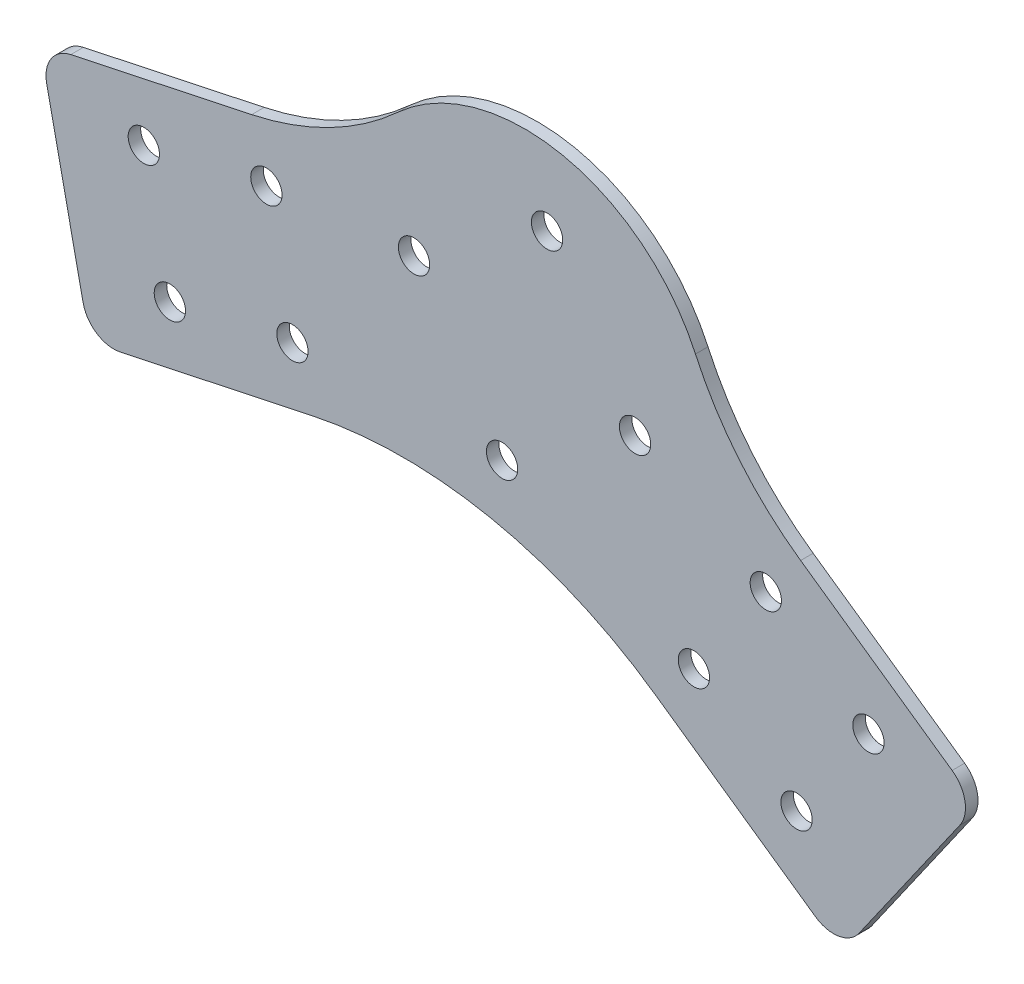
from build123d import *

# Parameters (mm, degrees)
SKETCH1_R           = 2.5
BOSS_EXTRUDE1_DEPTH = 2
FILLET1_R           = 50
FILLET2_R           = 70
FILLET3_R           = 5


with BuildPart() as part:
    # Sketch1 → Boss-Extrude1 (new body)
    with BuildSketch(Plane.XY):
        with BuildLine():
            Line((-77.311392181, 2.991427603), (-69.410747929, -34.178181225))
            Line((-69.410747929, -34.178181225), (-4.13058082, -20.302453359))
            Line((-4.13058082, -20.302453359), (50.538451031, -58.582121568))
            Line((50.538451031, -58.582121568), (72.334355612, -27.454343885))
            Line((72.334355612, -27.454343885), (29.915692131, 2.247524046))
            ThreePointArc((29.915692131, 2.247524046), (5.981038033, 29.397741139), (-26.659362194, 13.757848938))
            Line((-26.659362194, 13.757848938), (-77.311392181, 2.991427603))
        make_face()
        with Locations((-60.767972952, -2.693225442)):
            Circle(SKETCH1_R, mode=Mode.SUBTRACT)
        with Locations(Location((-56.609739136, -22.256177456, 0), (0, 0, 180))):
            Circle(SKETCH1_R, mode=Mode.SUBTRACT)
        with Locations((-37.046787121, -18.09794364)):
            Circle(SKETCH1_R, mode=Mode.SUBTRACT)
        with Locations(Location((-41.205020938, 1.465008375, 0), (0, 0, 180))):
            Circle(SKETCH1_R, mode=Mode.SUBTRACT)
        with Locations((38.501846135, -14.751537011)):
            Circle(SKETCH1_R, mode=Mode.SUBTRACT)
        with Locations(Location((27.030317408, -31.134577897, 0), (0, 0, 180))):
            Circle(SKETCH1_R, mode=Mode.SUBTRACT)
        with Locations((43.413358294, -42.606106624)):
            Circle(SKETCH1_R, mode=Mode.SUBTRACT)
        with Locations(Location((54.884887021, -26.223065738, 0), (0, 0, 180))):
            Circle(SKETCH1_R, mode=Mode.SUBTRACT)
        with Locations((3.58862282, 17.638644683)):
            Circle(SKETCH1_R, mode=Mode.SUBTRACT)
        with Locations((17.638644683, -3.58862282)):
            Circle(SKETCH1_R, mode=Mode.SUBTRACT)
        with Locations((-3.58862282, -17.638644683)):
            Circle(SKETCH1_R, mode=Mode.SUBTRACT)
        with Locations((-17.638644683, 3.58862282)):
            Circle(SKETCH1_R, mode=Mode.SUBTRACT)
    extrude(amount=BOSS_EXTRUDE1_DEPTH)

    # Fillet1
    fillet1_edges = [part.edges().sort_by_distance(p)[0] for p in [
        (-26.659362194, 13.757848938, 1),
        (29.915692131, 2.247524046, 1),
    ]]
    fillet(fillet1_edges, radius=FILLET1_R)

    # Fillet2
    fillet2_edges = [part.edges().sort_by_distance(p)[0] for p in [
        (-4.13058082, -20.302453359, 1),
    ]]
    fillet(fillet2_edges, radius=FILLET2_R)

    # Fillet3
    fillet3_edges = [part.edges().sort_by_distance(p)[0] for p in [
        (72.334355612, -27.454343885, 1),
        (50.538451031, -58.582121568, 1),
        (-69.410747929, -34.178181225, 1),
        (-77.311392181, 2.991427603, 1),
    ]]
    fillet(fillet3_edges, radius=FILLET3_R)


solid = part.part
